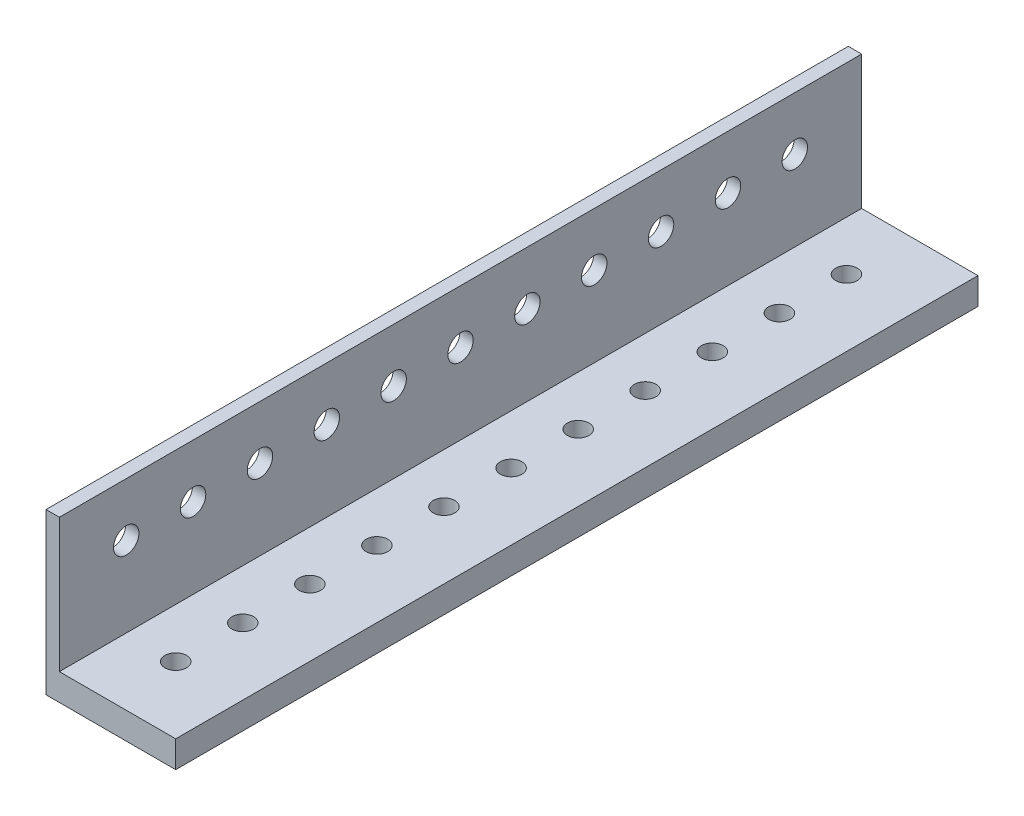
from build123d import *

# Parameters (mm, degrees)
SKETCH1_W           = 152.4
SKETCH1_H           = 30.48
SKETCH1_R           = 2.413
BOSS_EXTRUDE1_DEPTH = 2.54
SKETCH2_W           = 152.4
SKETCH2_H           = 5.08
BOSS_EXTRUDE2_DEPTH = 22.098
SKETCH3_R           = 2.054469346
CUT_EXTRUDE1_DEPTH  = 146.561723888


with BuildPart() as part:
    # Sketch1 → Boss-Extrude1 (new body)
    with BuildSketch(Plane(origin=(0, 0, 0), x_dir=(0, 0, -1), z_dir=(1, 0, 0))):
        with Locations((64.994987224, -0.229680851)):
            Rectangle(SKETCH1_W, SKETCH1_H)
        with Locations((1.494987224, 4.850319149)):
            Circle(SKETCH1_R, mode=Mode.SUBTRACT)
        with Locations((14.194987224, 4.850319149)):
            Circle(SKETCH1_R, mode=Mode.SUBTRACT)
        with Locations((26.894987224, 4.850319149)):
            Circle(SKETCH1_R, mode=Mode.SUBTRACT)
        with Locations((39.594987224, 4.850319149)):
            Circle(SKETCH1_R, mode=Mode.SUBTRACT)
        with Locations((52.294987224, 4.850319149)):
            Circle(SKETCH1_R, mode=Mode.SUBTRACT)
        with Locations((64.994987224, 4.850319149)):
            Circle(SKETCH1_R, mode=Mode.SUBTRACT)
        with Locations((77.694987224, 4.850319149)):
            Circle(SKETCH1_R, mode=Mode.SUBTRACT)
        with Locations((90.394987224, 4.850319149)):
            Circle(SKETCH1_R, mode=Mode.SUBTRACT)
        with Locations((103.094987224, 4.850319149)):
            Circle(SKETCH1_R, mode=Mode.SUBTRACT)
        with Locations((115.794987224, 4.850319149)):
            Circle(SKETCH1_R, mode=Mode.SUBTRACT)
        with Locations((128.494987224, 4.850319149)):
            Circle(SKETCH1_R, mode=Mode.SUBTRACT)
    extrude(amount=BOSS_EXTRUDE1_DEPTH)

    # Sketch2 → Boss-Extrude2 (add)
    with BuildSketch(Plane(origin=(2.54, 0, 0), x_dir=(0, 0, -1), z_dir=(1, 0, 0))):
        with Locations((64.994987224, -12.929680851)):
            Rectangle(SKETCH2_W, SKETCH2_H)
    extrude(amount=BOSS_EXTRUDE2_DEPTH)

    # Sketch3 → Cut-Extrude1 (cut, through all)
    with BuildSketch(Plane(origin=(0, -10.389680851, 0), x_dir=(1, 0, 0), z_dir=(0, 1, 0))):
        with Locations(Location((11.938, 1.494987224, 0), (0, 0, 270))):
            Circle(SKETCH3_R)
        with Locations(Location((11.938, 14.236129272, 0), (0, 0, 270))):
            Circle(SKETCH3_R)
        with Locations(Location((11.938, 26.977271321, 0), (0, 0, 270))):
            Circle(SKETCH3_R)
        with Locations(Location((11.938, 39.71841337, 0), (0, 0, 270))):
            Circle(SKETCH3_R)
        with Locations(Location((11.938, 52.459555419, 0), (0, 0, 270))):
            Circle(SKETCH3_R)
        with Locations(Location((11.938, 65.200697467, 0), (0, 0, 270))):
            Circle(SKETCH3_R)
        with Locations(Location((11.938, 77.941839516, 0), (0, 0, 270))):
            Circle(SKETCH3_R)
        with Locations(Location((11.938, 90.682981565, 0), (0, 0, 270))):
            Circle(SKETCH3_R)
        with Locations(Location((11.938, 103.424123614, 0), (0, 0, 270))):
            Circle(SKETCH3_R)
        with Locations(Location((11.938, 116.165265662, 0), (0, 0, 270))):
            Circle(SKETCH3_R)
        with Locations(Location((11.938, 128.906407711, 0), (0, 0, 270))):
            Circle(SKETCH3_R)
    extrude(amount=-CUT_EXTRUDE1_DEPTH, mode=Mode.SUBTRACT)


solid = part.part
